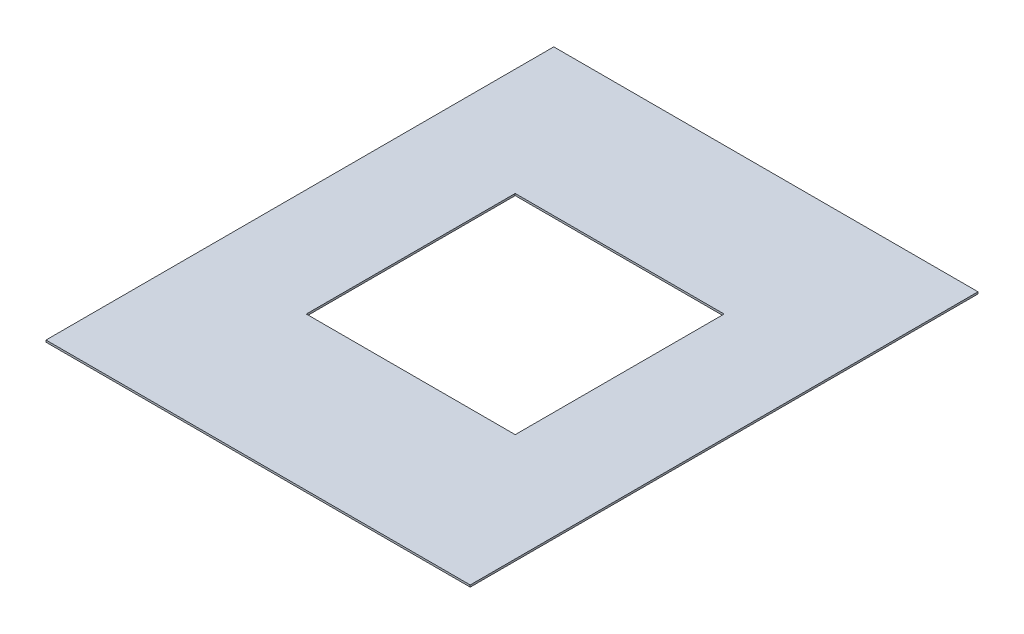
from build123d import *

# Parameters (mm, degrees)
SKETCH1_W                            = 660
SKETCH1_H                            = 3
PACK_KALIP_PLAKASI_3MM_66X79_1_DEPTH = 790
PACK_KALIP_PLAKASI_3MM_66X79_2_START = -237.5
SKETCH2_W                            = 325
SKETCH2_H                            = 5
PACK_KALIP_PLAKASI_3MM_66X79_2_DEPTH = 325


with BuildPart() as part:
    # Sketch1 → PACK_kalip_plakasi_3mm_66x79_1 (new body)
    with BuildSketch(Plane.XY):
        with Locations((350, 598.5)):
            Rectangle(SKETCH1_W, SKETCH1_H)
    extrude(amount=-PACK_KALIP_PLAKASI_3MM_66X79_1_DEPTH)

    # Sketch2 → PACK_kalip_plakasi_3mm_66x79_2 (cut)
    with BuildSketch(Plane.XY.offset(PACK_KALIP_PLAKASI_3MM_66X79_2_START)):
        with Locations((350, 598.5)):
            Rectangle(SKETCH2_W, SKETCH2_H)
    extrude(amount=-PACK_KALIP_PLAKASI_3MM_66X79_2_DEPTH, mode=Mode.SUBTRACT)


solid = part.part
